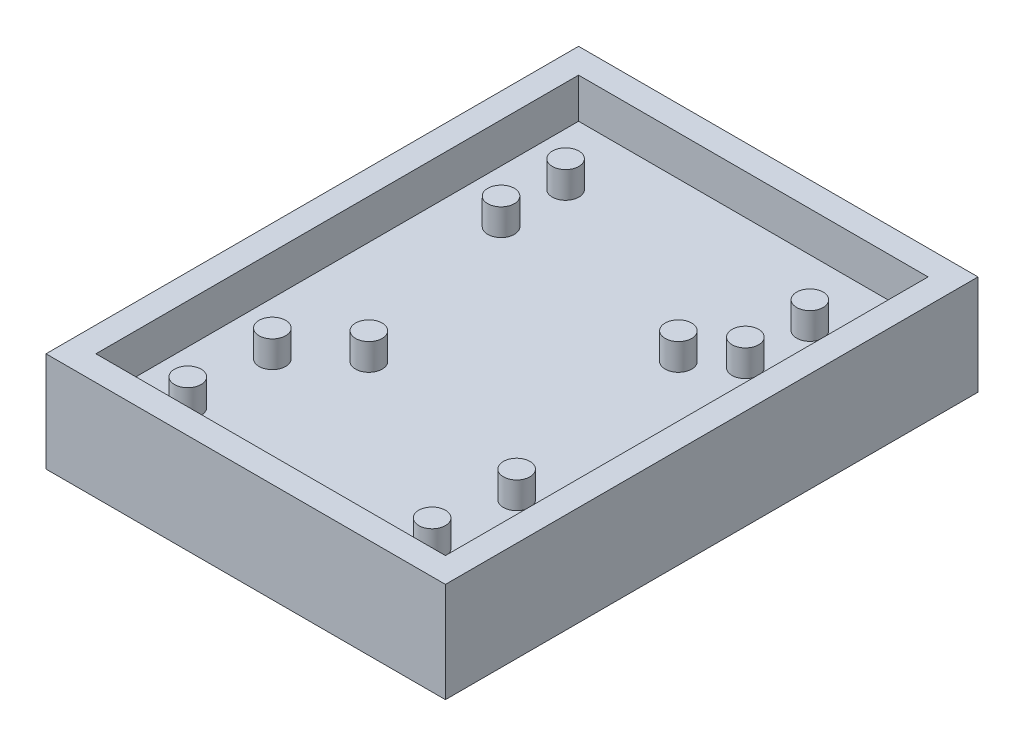
from build123d import *

# Parameters (mm, degrees)
SKETCH1_W           = 120
SKETCH1_H           = 160
BOSS_EXTRUDE1_DEPTH = 30
SKETCH2_W           = 105
SKETCH2_H           = 145
CUT_EXTRUDE1_DEPTH  = 12
SKETCH3_R           = 4
BOSS_EXTRUDE2_DEPTH = 8


with BuildPart() as part:
    # Sketch1 → Boss-Extrude1 (new body)
    with BuildSketch(Plane(origin=(0, 0, 0), x_dir=(1, 0, 0), z_dir=(0, 1, 0))):
        Rectangle(SKETCH1_W, SKETCH1_H)
    extrude(amount=BOSS_EXTRUDE1_DEPTH)

    # Sketch2 → Cut-Extrude1 (cut)
    with BuildSketch(Plane(origin=(0, 30, 0), x_dir=(1, 0, 0), z_dir=(0, 1, 0))):
        Rectangle(SKETCH2_W, SKETCH2_H)
    extrude(amount=-CUT_EXTRUDE1_DEPTH, mode=Mode.SUBTRACT)

    # Sketch3 → Boss-Extrude2 (add)
    with BuildSketch(Plane(origin=(0, 18, 0), x_dir=(1, 0, 0), z_dir=(0, 1, 0))):
        with Locations(Location((-21.5, -21.5, 0), (0, 0, 90))):
            Circle(SKETCH3_R)
        with Locations(Location((25, 25, 0), (0, 0, 90))):
            Circle(SKETCH3_R)
        with Locations(Location((-36.7, -35.3, 0), (0, 0, 90))):
            Circle(SKETCH3_R)
        with Locations(Location((36.7, -35.3, 0), (0, 0, 90))):
            Circle(SKETCH3_R)
        with Locations(Location((36.7, -60.7, 0), (0, 0, 90))):
            Circle(SKETCH3_R)
        with Locations(Location((-36.7, -60.7, 0), (0, 0, 90))):
            Circle(SKETCH3_R)
        with Locations(Location((36.7, 33.409623616, 0), (0, 0, 90))):
            Circle(SKETCH3_R)
        with Locations(Location((-36.7, 33.409623616, 0), (0, 0, 90))):
            Circle(SKETCH3_R)
        with Locations(Location((-36.7, 52.809623616, 0), (0, 0, 90))):
            Circle(SKETCH3_R)
        with Locations(Location((36.7, 52.809623616, 0), (0, 0, 90))):
            Circle(SKETCH3_R)
    extrude(amount=BOSS_EXTRUDE2_DEPTH)


solid = part.part
